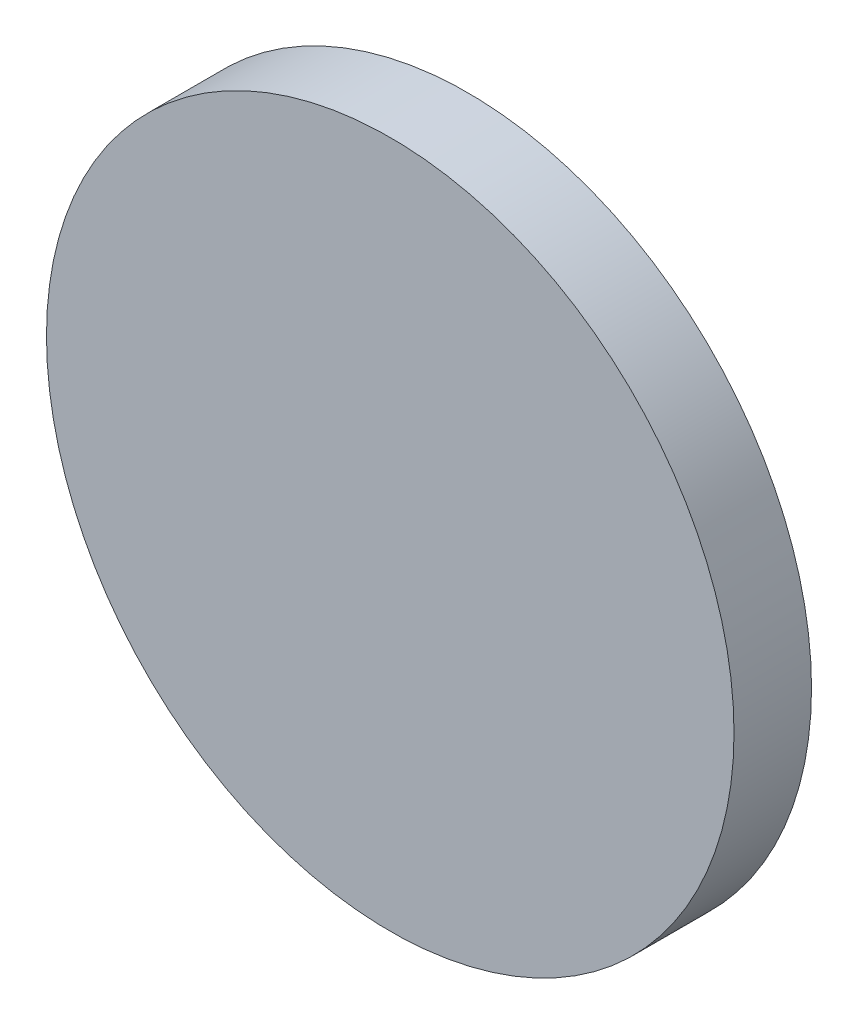
from build123d import *

# Parameters (mm, degrees)
SKETCH1_R           = 28.1625529
BOSS_EXTRUDE1_DEPTH = 6.35


with BuildPart() as part:
    # Sketch1 → Boss-Extrude1 (new body)
    with BuildSketch(Plane.XY):
        Circle(SKETCH1_R)
    extrude(amount=BOSS_EXTRUDE1_DEPTH)


solid = part.part
